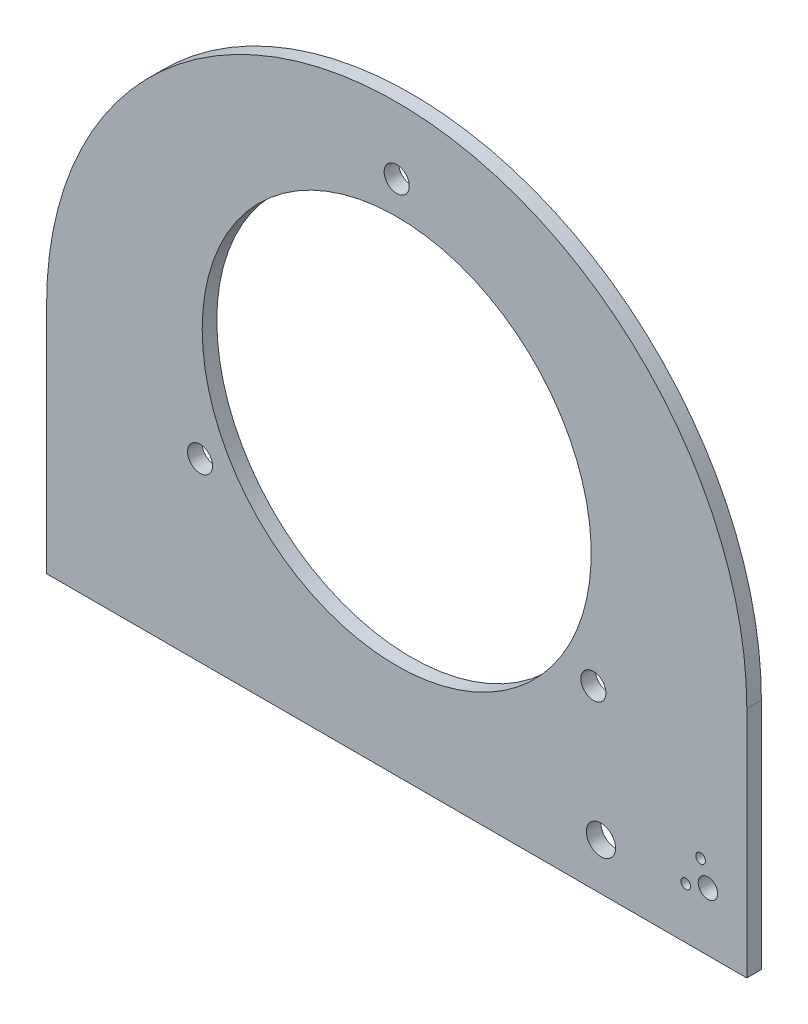
from build123d import *

# Parameters (mm, degrees)
SKETCH1_R           = 127
SKETCH1_R_2         = 8.198770857
SKETCH1_R_3         = 6.35
SKETCH1_R_4         = 3.175
SKETCH1_R_5         = 9.525
BOSS_EXTRUDE1_DEPTH = 9.525


with BuildPart() as part:
    # Sketch1 → Boss-Extrude1 (new body)
    with BuildSketch(Plane.XY):
        with BuildLine():
            Line((-228.6, -36.83), (-228.6, -189.23))
            Line((-228.6, -189.23), (228.6, -189.23))
            Line((228.6, -189.23), (228.6, -36.83))
            ThreePointArc((228.6, -36.83), (0, 191.77), (-228.6, -36.83))
        make_face()
        with Locations(Location((0, 0, 0), (0, 0, 180))):
            Circle(SKETCH1_R, mode=Mode.SUBTRACT)
        with Locations(Location((0, 148.2852, 0), (0, 0, 180))):
            Circle(SKETCH1_R_2, mode=Mode.SUBTRACT)
        with Locations(Location((128.418750205, -74.1426, 0), (0, 0, 180))):
            Circle(SKETCH1_R_2, mode=Mode.SUBTRACT)
        with Locations(Location((-128.418750205, -74.1426, 0), (0, 0, 180))):
            Circle(SKETCH1_R_2, mode=Mode.SUBTRACT)
        with Locations(Location((203.2, -151.13, 0), (0, 0, 180))):
            Circle(SKETCH1_R_3, mode=Mode.SUBTRACT)
        with Locations(Location((188.723253344, -155.8925, 0), (0, 0, 180))):
            Circle(SKETCH1_R_4, mode=Mode.SUBTRACT)
        with Locations(Location((198.4375, -136.653253344, 0), (0, 0, 180))):
            Circle(SKETCH1_R_4, mode=Mode.SUBTRACT)
        with Locations(Location((133.35, -158.75, 0), (0, 0, 180))):
            Circle(SKETCH1_R_5, mode=Mode.SUBTRACT)
    extrude(amount=BOSS_EXTRUDE1_DEPTH)


solid = part.part
